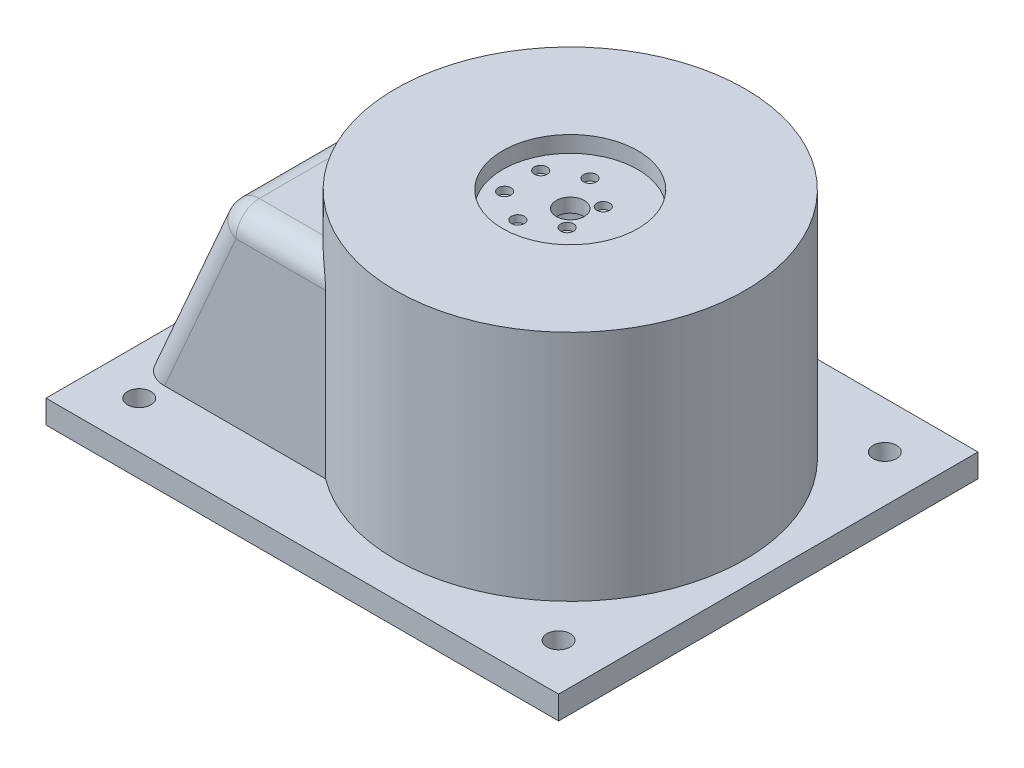
from build123d import *

# Parameters (mm, degrees)
SKETCH1_R                = 75
BOSS_EXTRUDE1_DEPTH      = 100
SKETCH5_R                = 29
CUT_EXTRUDE2_DEPTH       = 7
BOSS_EXTRUDE2_DEPTH      = 60
BOSS_EXTRUDE2_DEPTH_BACK = 60
SKETCH8_W                = 220
SKETCH8_H                = 180
BOSS_EXTRUDE3_DEPTH      = 10
SKETCH9_R                = 5
CUT_EXTRUDE4_DEPTH       = 10
FILLET1_R                = 10
SKETCH14_R               = 6
CUT_EXTRUDE6_DEPTH       = 110
SKETCH15_R               = 18.5
CUT_EXTRUDE7_DEPTH       = 97
SKETCH16_R               = 1.5
CUT_EXTRUDE8_DEPTH       = 7
SKETCH17_R               = 55
CUT_EXTRUDE9_DEPTH       = 73
SKETCH21_W               = 60
SKETCH21_H               = 80
CUT_EXTRUDE10_DEPTH      = 73
SKETCH23_R               = 2.75
CUT_EXTRUDE11_DEPTH      = 3
CUT_EXTRUDE15_DEPTH      = 40
CUT_EXTRUDE15_DEPTH_BACK = 40


with BuildPart() as part:
    # Sketch1 → Boss-Extrude1 (new body)
    with BuildSketch(Plane(origin=(0, 0, 0), x_dir=(1, 0, 0), z_dir=(0, 1, 0))):
        Circle(SKETCH1_R)
    extrude(amount=BOSS_EXTRUDE1_DEPTH)

    # Sketch5 → Cut-Extrude2 (cut)
    with BuildSketch(Plane(origin=(0, 100, 0), x_dir=(1, 0, 0), z_dir=(0, 1, 0))):
        Circle(SKETCH5_R)
    extrude(amount=-CUT_EXTRUDE2_DEPTH, mode=Mode.SUBTRACT)

    # Sketch2 → Boss-Extrude2 (add, two sides: drawn at the far end of the back side and taken through both)
    with BuildSketch(Plane.XY.offset(-BOSS_EXTRUDE2_DEPTH_BACK)):
        Polygon((0, 0), (-125, 0), (-90, 80), (0, 80), align=None)
    extrude(amount=BOSS_EXTRUDE2_DEPTH + BOSS_EXTRUDE2_DEPTH_BACK)

    # Sketch8 → Boss-Extrude3 (add)
    with BuildSketch(Plane.XZ):
        with Locations((-25, 0)):
            Rectangle(SKETCH8_W, SKETCH8_H)
    extrude(amount=BOSS_EXTRUDE3_DEPTH)

    # Sketch9 → Cut-Extrude4 (cut)
    with BuildSketch(Plane.XZ.offset(10)):
        with Locations((-115, 70)):
            Circle(SKETCH9_R)
        with Locations((65, 70)):
            Circle(SKETCH9_R)
        with Locations((65, -70)):
            Circle(SKETCH9_R)
        with Locations((-115, -70)):
            Circle(SKETCH9_R)
    extrude(amount=-CUT_EXTRUDE4_DEPTH, mode=Mode.SUBTRACT)

    # Fillet1
    fillet1_edges = [part.edges().sort_by_distance(p)[0] for p in [
        (-107.5, 40, 60),
        (-67.5, 80, 60),
        (-90, 80, 0),
        (-107.5, 40, -60),
        (-67.5, 80, -60),
    ]]
    fillet(fillet1_edges, radius=FILLET1_R)

    # Sketch14 → Cut-Extrude6 (cut)
    with BuildSketch(Plane(origin=(0, 93, 0), x_dir=(1, 0, 0), z_dir=(0, 1, 0))):
        Circle(SKETCH14_R)
    extrude(amount=-CUT_EXTRUDE6_DEPTH, mode=Mode.SUBTRACT)

    # Sketch15 → Cut-Extrude7 (cut)
    with BuildSketch(Plane.XZ.offset(10)):
        with Locations((-7, 0)):
            Circle(SKETCH15_R)
    extrude(amount=-CUT_EXTRUDE7_DEPTH, mode=Mode.SUBTRACT)

    # Sketch16 → Cut-Extrude8 (cut)
    with BuildSketch(Plane.XZ.offset(-87)):
        with Locations((-7, 15.5)):
            Circle(SKETCH16_R)
        with Locations((6.423393759, 7.75)):
            Circle(SKETCH16_R)
        with Locations((6.423393759, -7.75)):
            Circle(SKETCH16_R)
        with Locations((-7, -15.5)):
            Circle(SKETCH16_R)
        with Locations((-20.423393759, -7.75)):
            Circle(SKETCH16_R)
        with Locations((-20.423393759, 7.75)):
            Circle(SKETCH16_R)
    extrude(amount=-CUT_EXTRUDE8_DEPTH, mode=Mode.SUBTRACT)

    # Sketch17 → Cut-Extrude9 (cut)
    with BuildSketch(Plane.XZ.offset(10)):
        Circle(SKETCH17_R)
    extrude(amount=-CUT_EXTRUDE9_DEPTH, mode=Mode.SUBTRACT)

    # Sketch21 → Cut-Extrude10 (cut)
    with BuildSketch(Plane.XZ.offset(10)):
        with Locations((-30, 0)):
            Rectangle(SKETCH21_W, SKETCH21_H)
    extrude(amount=-CUT_EXTRUDE10_DEPTH, mode=Mode.SUBTRACT)

    # Sketch23 → Cut-Extrude11 (cut)
    with BuildSketch(Plane(origin=(0, 93, 0), x_dir=(1, 0, 0), z_dir=(0, 1, 0))):
        with Locations((-7, 15.5)):
            Circle(SKETCH23_R)
        with Locations((6.423393759, 7.75)):
            Circle(SKETCH23_R)
        with Locations((6.423393759, -7.75)):
            Circle(SKETCH23_R)
        with Locations((-7, -15.5)):
            Circle(SKETCH23_R)
        with Locations((-20.423393759, -7.75)):
            Circle(SKETCH23_R)
        with Locations((-20.423393759, 7.75)):
            Circle(SKETCH23_R)
    extrude(amount=-CUT_EXTRUDE11_DEPTH, mode=Mode.SUBTRACT)

    # Sketch27 → Cut-Extrude15 (cut, two sides: drawn at the far end of the back side and taken through both)
    with BuildSketch(Plane.XY.offset(-CUT_EXTRUDE15_DEPTH_BACK)):
        Polygon((-25, -10), (-25, 63), (-74.613551793, 63), (-106.551051793, -10), align=None)
    extrude(amount=CUT_EXTRUDE15_DEPTH + CUT_EXTRUDE15_DEPTH_BACK, mode=Mode.SUBTRACT)


solid = part.part
